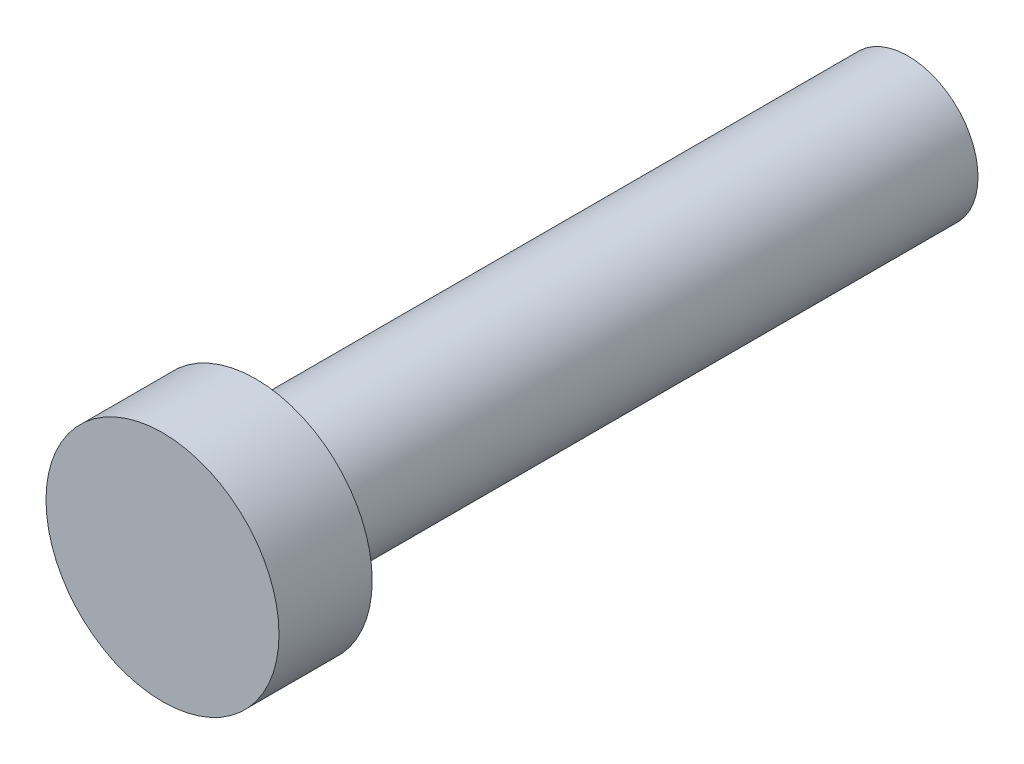
from build123d import *

# Parameters (mm, degrees)
ESQUISSE1_R        = 1.5
BOSS_EXTRU_1_DEPTH = 14
ESQUISSE2_R        = 2.5
BOSS_EXTRU_2_DEPTH = 2


with BuildPart() as part:
    # Esquisse1 → Boss.-Extru.1 (new body)
    with BuildSketch(Plane.XY):
        Circle(ESQUISSE1_R)
    extrude(amount=-BOSS_EXTRU_1_DEPTH)

    # Esquisse2 → Boss.-Extru.2 (add)
    with BuildSketch(Plane.XY):
        Circle(ESQUISSE2_R)
    extrude(amount=BOSS_EXTRU_2_DEPTH)


solid = part.part
